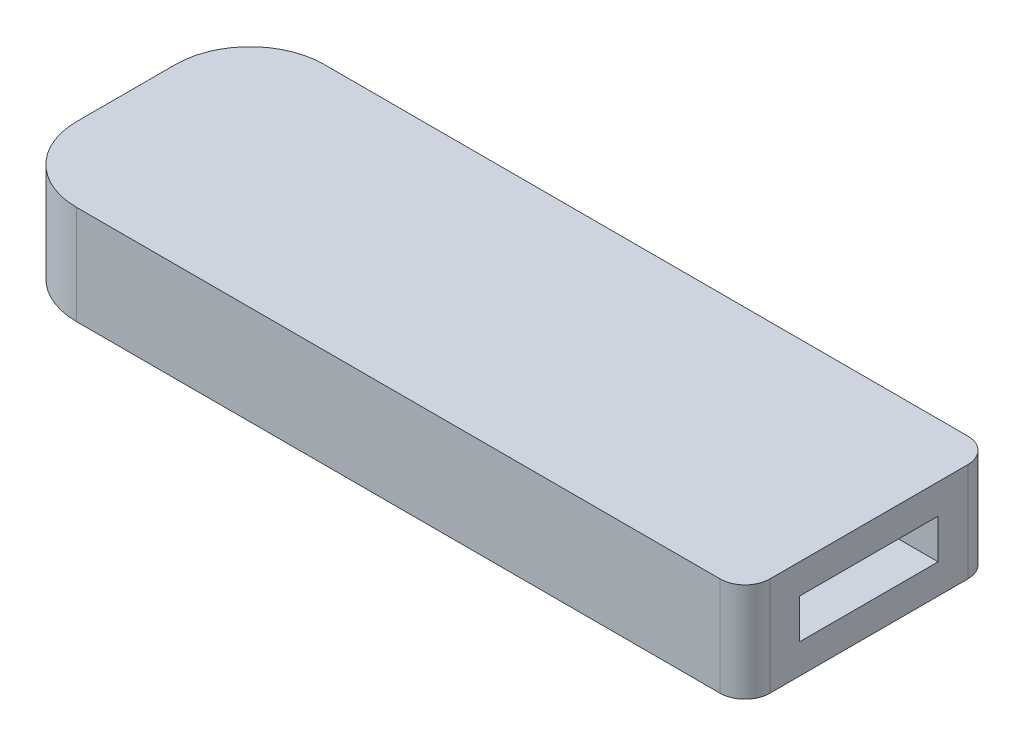
from build123d import *

# Parameters (mm, degrees)
SKETCH1_W           = 30
SKETCH1_H           = 10
BOSS_EXTRUDE1_DEPTH = 4
SKETCH2_W           = 5.6
SKETCH2_H           = 1.6
CUT_EXTRUDE1_DEPTH  = 13
FILLET1_R           = 3
FILLET2_R           = 1


with BuildPart() as part:
    # Sketch1 → Boss-Extrude1 (new body)
    with BuildSketch(Plane(origin=(0, 0, 0), x_dir=(1, 0, 0), z_dir=(0, 1, 0))):
        with Locations((-15, 5)):
            Rectangle(SKETCH1_W, SKETCH1_H)
    extrude(amount=BOSS_EXTRUDE1_DEPTH)

    # Sketch2 → Cut-Extrude1 (cut)
    with BuildSketch(Plane(origin=(0, 0, 0), x_dir=(0, 0, -1), z_dir=(1, 0, 0))):
        with Locations((5, 2)):
            Rectangle(SKETCH2_W, SKETCH2_H)
    extrude(amount=-CUT_EXTRUDE1_DEPTH, mode=Mode.SUBTRACT)

    # Fillet1
    fillet1_edges = [part.edges().sort_by_distance(p)[0] for p in [
        (-30, 2, 0),
        (-30, 2, -10),
    ]]
    fillet(fillet1_edges, radius=FILLET1_R)

    # Fillet2
    fillet2_edges = [part.edges().sort_by_distance(p)[0] for p in [
        (0, 2, 0),
        (0, 2, -10),
    ]]
    fillet(fillet2_edges, radius=FILLET2_R)


solid = part.part
